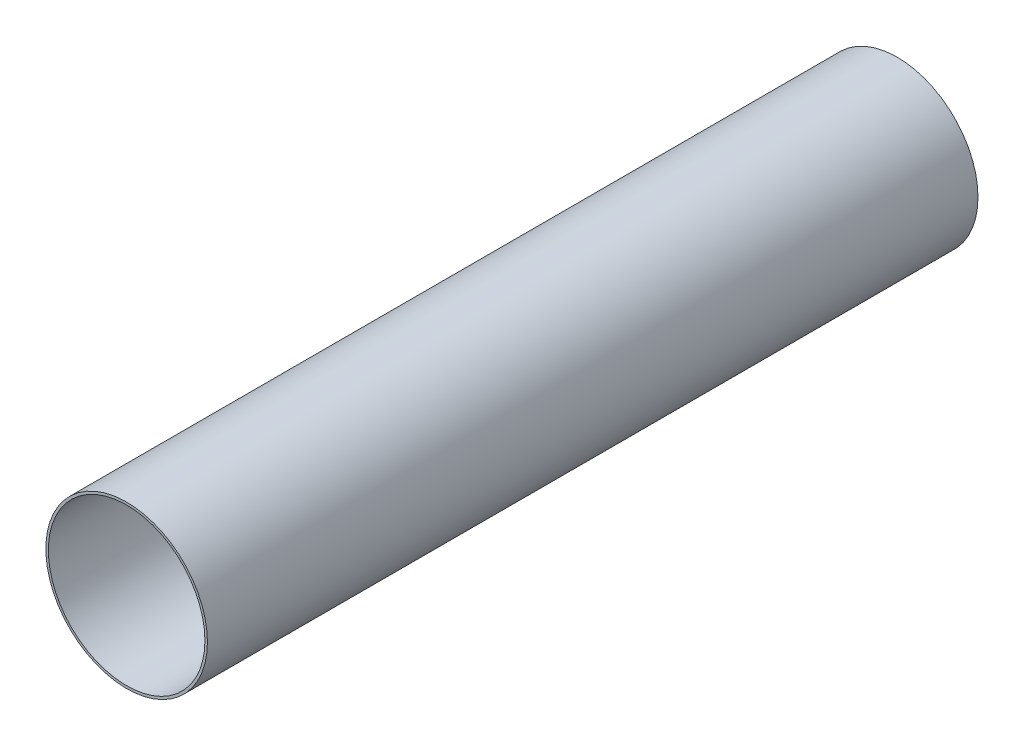
from build123d import *

# Parameters (mm, degrees)
ESBO_O1_R                = 32.5
ESBO_O1_R_2              = 31.5
RESSALTO_EXTRUS_O1_DEPTH = 310


with BuildPart() as part:
    # Esboço1 → Ressalto-extrusão1 (new body)
    with BuildSketch(Plane.XY):
        Circle(ESBO_O1_R)
        Circle(ESBO_O1_R_2, mode=Mode.SUBTRACT)
    extrude(amount=RESSALTO_EXTRUS_O1_DEPTH)


solid = part.part
